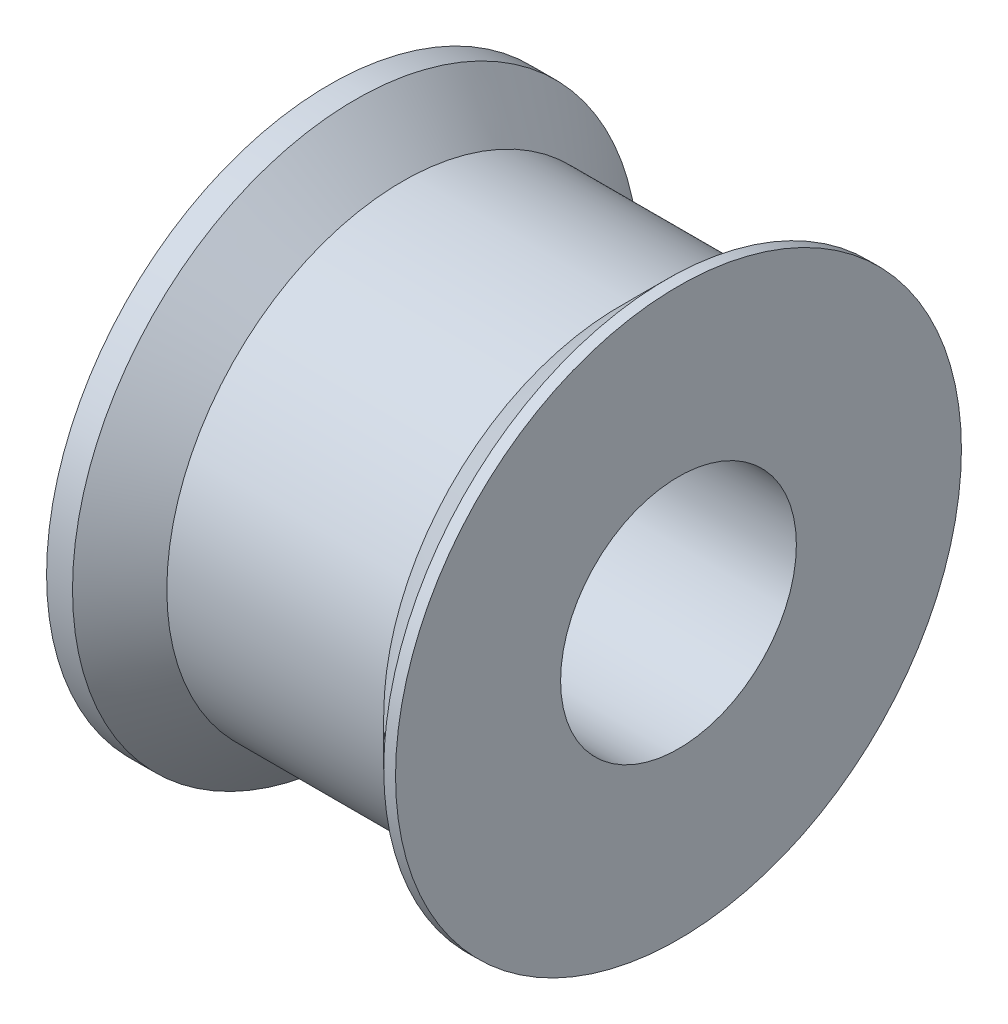
from build123d import *

# Parameters (mm, degrees)
SKETCH3_R          = 2
CUT_EXTRUDE1_DEPTH = 14.8
CUT_EXTRUDE2_START = -2
SKETCH4_R          = 5
CUT_EXTRUDE2_DEPTH = 12.8


with BuildPart() as part:
    # Sketch2 → Revolve1 (revolve)
    with BuildSketch(Plane(origin=(0, 0, 0), x_dir=(1, 0, 0), z_dir=(0, 1, 0))):
        Polygon((-7.7, 12), (-7.7, 0), (-7.1, 0), (7.1, 0), (7.1, 12), (6.6, 12), (4.6, 10), (-4.6, 10), (-6.6, 12), (-7.1, 12), align=None)
    revolve(axis=Axis((7.1, 0, 0), (-1, 0, 0)))

    # Sketch3 → Cut-Extrude1 (cut)
    with BuildSketch(Plane.ZY.offset(7.7)):
        Circle(SKETCH3_R)
    extrude(amount=-CUT_EXTRUDE1_DEPTH, mode=Mode.SUBTRACT)

    # Sketch4 → Cut-Extrude2 (cut)
    with BuildSketch(Plane.ZY.offset(7.7).offset(CUT_EXTRUDE2_START)):
        Circle(SKETCH4_R)
    extrude(amount=-CUT_EXTRUDE2_DEPTH, mode=Mode.SUBTRACT)


solid = part.part
